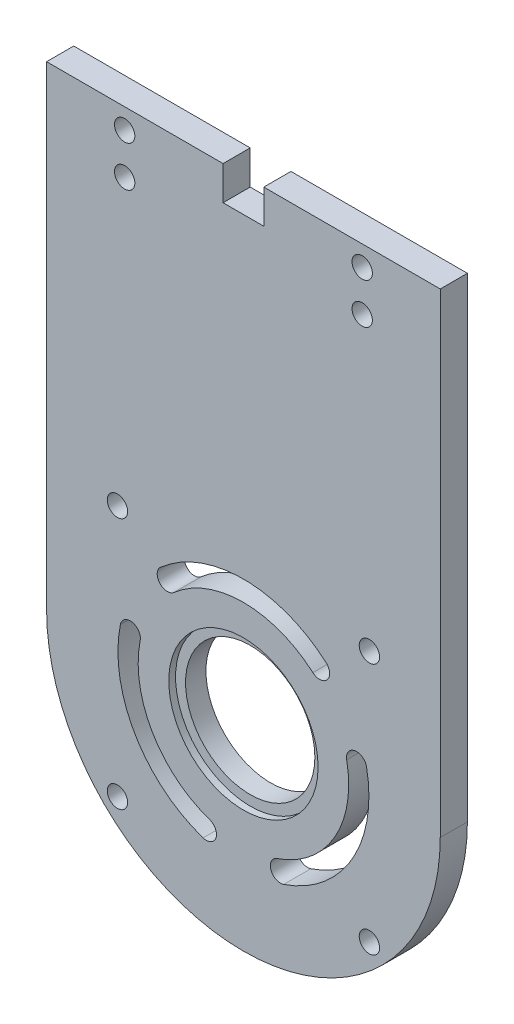
from build123d import *

# Parameters (mm, degrees)
SKETCH_1_R          = 9.525
SKETCH_1_R_2        = 1.5
EXTRUDE_1_DEPTH     = 4
SKETCH_2_W          = 6
SKETCH_2_H          = 5
CUT_EXTRUDE_1_DEPTH = 98.49871794
CUT_EXTRUDE_2_DEPTH = 10
SKETCH_4_R          = 11
CUT_EXTRUDE_3_DEPTH = 1


with BuildPart() as part:
    # 草图1 → 凸台-拉伸1 (new body)
    with BuildSketch(Plane.XY):
        with BuildLine():
            Line((-29, 6), (29, 6))
            Line((29, 6), (29, -64))
            ThreePointArc((29, -64), (0, -93), (-29, -64))
            Line((-29, -64), (-29, 6))
        make_face()
        with Locations((0, -64)):
            Circle(SKETCH_1_R, mode=Mode.SUBTRACT)
        with Locations((-17.5, 3)):
            Circle(SKETCH_1_R_2, mode=Mode.SUBTRACT)
        with Locations((17.5, 3)):
            Circle(SKETCH_1_R_2, mode=Mode.SUBTRACT)
        with Locations((18.561553006, -82.561553006)):
            Circle(SKETCH_1_R_2, mode=Mode.SUBTRACT)
        with Locations((-18.561553006, -82.561553006)):
            Circle(SKETCH_1_R_2, mode=Mode.SUBTRACT)
        with Locations((-18.561553006, -45.438446994)):
            Circle(SKETCH_1_R_2, mode=Mode.SUBTRACT)
        with Locations((18.561553006, -45.438446994)):
            Circle(SKETCH_1_R_2, mode=Mode.SUBTRACT)
        with Locations((-17.5, -3)):
            Circle(SKETCH_1_R_2, mode=Mode.SUBTRACT)
        with Locations((17.5, -3)):
            Circle(SKETCH_1_R_2, mode=Mode.SUBTRACT)
    extrude(amount=EXTRUDE_1_DEPTH)

    # 草图2 → 切除-拉伸1 (cut, through all)
    with BuildSketch(Plane.XY.offset(4)):
        with Locations((0, 3.5)):
            Rectangle(SKETCH_2_W, SKETCH_2_H)
    extrude(amount=-CUT_EXTRUDE_1_DEPTH, mode=Mode.SUBTRACT)

    # 草图3 → 切除-拉伸2 (cut)
    with BuildSketch(Plane.XY.offset(4)):
        with BuildLine():
            ThreePointArc((12.196146044, -50.10328221), (0, -45.510415266), (-12.196146044, -50.10328221))
            ThreePointArc((-12.196146044, -50.10328221), (-12.333149971, -52.20541334), (-10.231018841, -52.342417267))
            ThreePointArc((-10.231018841, -52.342417267), (0, -48.489584734), (10.231018841, -52.342417267))
            ThreePointArc((10.231018841, -52.342417267), (12.333149971, -52.20541334), (12.196146044, -50.10328221))
        make_face()
        with BuildLine():
            ThreePointArc((5.936837613, -81.510531197), (16.012450085, -73.244792367), (18.132983657, -60.386186592))
            ThreePointArc((18.132983657, -60.386186592), (16.38098666, -59.216472147), (15.211272214, -60.968469144))
            ThreePointArc((15.211272214, -60.968469144), (13.432413643, -71.755207633), (4.980253373, -78.68911359))
            ThreePointArc((4.980253373, -78.68911359), (4.047836689, -80.578114513), (5.936837613, -81.510531197))
        make_face()
        with BuildLine():
            ThreePointArc((-18.132983657, -60.386186592), (-16.012450085, -73.244792367), (-5.936837613, -81.510531197))
            ThreePointArc((-5.936837613, -81.510531197), (-4.047836689, -80.578114513), (-4.980253373, -78.68911359))
            ThreePointArc((-4.980253373, -78.68911359), (-13.432413643, -71.755207633), (-15.211272214, -60.968469144))
            ThreePointArc((-15.211272214, -60.968469144), (-16.38098666, -59.216472147), (-18.132983657, -60.386186592))
        make_face()
    extrude(amount=-CUT_EXTRUDE_2_DEPTH, mode=Mode.SUBTRACT)

    # 草图4 → 切除-拉伸3 (cut)
    with BuildSketch(Plane.XY.offset(4)):
        with Locations((0, -64)):
            Circle(SKETCH_4_R)
    extrude(amount=-CUT_EXTRUDE_3_DEPTH, mode=Mode.SUBTRACT)


solid = part.part
